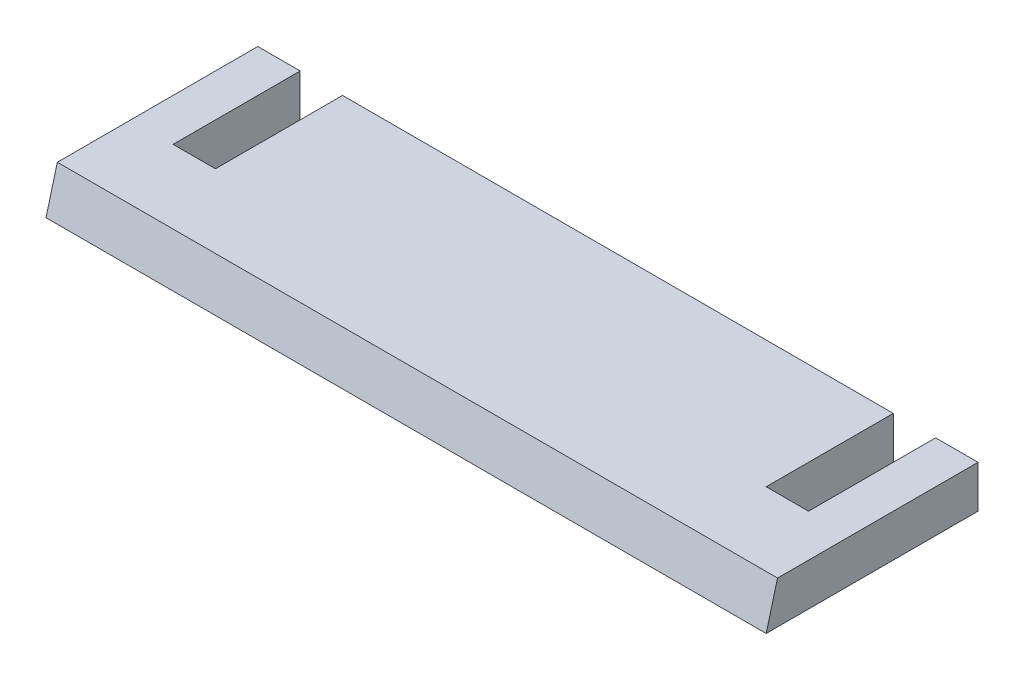
from build123d import *

# Parameters (mm, degrees)
BOSS_EXTRUDE1_DEPTH = 10
DRAFT1_ANGLE        = -15


with BuildPart() as part:
    # Sketch1 → Boss-Extrude1 (new body)
    with BuildSketch(Plane(origin=(0, 0, 0), x_dir=(1, 0, 0), z_dir=(0, 1, 0))):
        Polygon((85, -25), (-85, -25), (-85, 25), (-75, 25), (-75, -5), (-65, -5), (-65, 25), (65, 25), (65, -5), (75, -5), (75, 25), (85, 25), align=None)
    extrude(amount=BOSS_EXTRUDE1_DEPTH)

    # Draft1
    draft1_faces = [part.faces().sort_by_distance(p)[0] for p in [
        (0, 5, 25),
    ]]
    draft(draft1_faces, Plane(origin=(0, 0, 0), x_dir=(0, 0, -1), z_dir=(0, -1, 0)), DRAFT1_ANGLE)


solid = part.part
